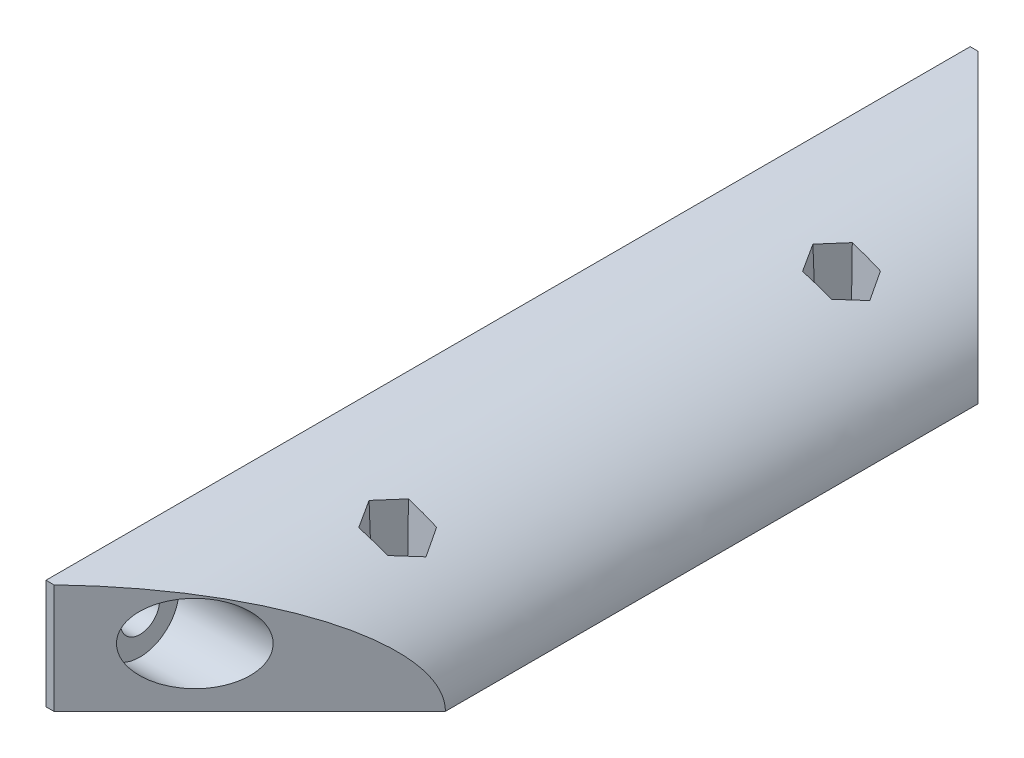
from build123d import *

# Parameters (mm, degrees)
EXTRU_MINCE1_DEPTH      = 118
ESQUISSE2_R             = 2.5
ENL_V_MAT_EXTRU_1_DEPTH = 4
ESQUISSE3_R             = 1.5
ENL_V_MAT_EXTRU_2_DEPTH = 4
CHANFREIN1_SIZE         = 25
BOSS_EXTRU_1_DEPTH      = 118
ESQUISSE5_R             = 2.5
ENL_V_MAT_EXTRU_3_DEPTH = 122.820564897
ESQUISSE6_R             = 1.5
ENL_V_MAT_EXTRU_4_DEPTH = 123.149498698
ENL_V_START             = -3
ESQUISSE8_R             = 5
ENL_V_MAT_EXTRU_5_DEPTH = 119.820564897
ENL_V_MAT_EXTRU_6_DEPTH = 119.9682337
ENL_V_MAT_EXTRU_6_TAPER = -2


with BuildPart() as part:
    # Esquisse1 → Extru.-Mince1 (new body)
    with BuildSketch(Plane.XY):
        Polygon((0, 15.5), (0, 0), (27.5, 0), (27.5, 1.5), (1.5, 1.5), (1.5, 15.5), align=None)
    extrude(amount=EXTRU_MINCE1_DEPTH)

    # Esquisse2 → Enlèv. mat.-Extru.1 (cut)
    with BuildSketch(Plane.ZY):
        with Locations(Location((9, 9, 0), (0, 0, 270))):
            Circle(ESQUISSE2_R)
        with Locations(Location((109, 9, 0), (0, 0, 90))):
            Circle(ESQUISSE2_R)
    extrude(amount=-ENL_V_MAT_EXTRU_1_DEPTH, mode=Mode.SUBTRACT)

    # Esquisse3 → Enlèv. mat.-Extru.2 (cut)
    with BuildSketch(Plane.XZ):
        with Locations(Location((15.771636742, 30.664864187, 0), (0, 0, 270))):
            Circle(ESQUISSE3_R)
        with Locations(Location((15.771636742, 87.335135813, 0), (0, 0, 90))):
            Circle(ESQUISSE3_R)
    extrude(amount=-ENL_V_MAT_EXTRU_2_DEPTH, mode=Mode.SUBTRACT)

    # Chanfrein1
    chanfrein1_edges = [part.edges().sort_by_distance(p)[0] for p in [
        (27.5, 0.75, 0),
        (27.5, 0.75, 118),
    ]]
    chamfer(chanfrein1_edges, length=CHANFREIN1_SIZE)


with BuildPart() as body_2:
    # Esquisse4 → Boss.-Extru.1 (new body)
    with BuildSketch(Plane(origin=(0, 0, 0), x_dir=(-1, 0, 0), z_dir=(0, 0, -1))):
        with BuildLine():
            Line((-27.5, 1.5), (-1.5, 1.5))
            Line((-1.5, 1.5), (-1.5, 15.5))
            add(Edge.make_bspline(
                [(-1.5, 15.5), (-27.5, 15.5), (-27.5, 1.5)],
                knots=[4.71238898, 4.71238898, 4.71238898, 6.283185307, 6.283185307, 6.283185307], degree=2, weights=[1, 0.707106781, 1]))
        make_face()
    extrude(amount=-BOSS_EXTRU_1_DEPTH)

    # Esquisse5 → Enlèv. mat.-Extru.3 (cut, through all)
    with BuildSketch(Plane.ZY.offset(-1.5)):
        with Locations(Location((109, 9, 0), (0, 0, 270))):
            Circle(ESQUISSE5_R)
        with Locations(Location((9, 9, 0), (0, 0, 270))):
            Circle(ESQUISSE5_R)
    extrude(amount=-ENL_V_MAT_EXTRU_3_DEPTH, mode=Mode.SUBTRACT)

    # Esquisse6 → Enlèv. mat.-Extru.4 (cut, through all)
    with BuildSketch(Plane.XZ):
        with Locations(Location((15.771636742, 87.335135813, 0), (0, 0, 270))):
            Circle(ESQUISSE6_R)
        with Locations(Location((15.771636742, 30.664864187, 0), (0, 0, 270))):
            Circle(ESQUISSE6_R)
        Polygon((27.5, 93), (2.5, 118), (27.5, 118), align=None)
        Polygon((2.5, 0), (27.5, 25), (27.5, 0), align=None)
    extrude(amount=-ENL_V_MAT_EXTRU_4_DEPTH, mode=Mode.SUBTRACT)

    # Esquisse8 → Enlèv. mat.-Extru.5 (cut, through all)
    with BuildSketch(Plane.ZY.offset(-1.5).offset(ENL_V_START)):
        with Locations(Location((9, 9, 0), (0, 0, 270))):
            Circle(ESQUISSE8_R)
        with Locations(Location((109, 9, 0), (0, 0, 270))):
            Circle(ESQUISSE8_R)
    extrude(amount=-ENL_V_MAT_EXTRU_5_DEPTH, mode=Mode.SUBTRACT)

    # Esquisse9 → Enlèv. mat.-Extru.6 (cut, through all)
    with BuildSketch(Plane.XZ.offset(-1.5).offset(ENL_V_START)):
        Polygon((19.062533276, 87.335135813), (17.417085009, 90.185135813), (14.126188475, 90.185135813), (12.480740208, 87.335135813), (14.126188475, 84.485135813), (17.417085009, 84.485135813), align=None)
        Polygon((17.417085009, 33.514864187), (14.126188475, 33.514864187), (12.480740208, 30.664864187), (14.126188475, 27.814864187), (17.417085009, 27.814864187), (19.062533276, 30.664864187), align=None)
    extrude(amount=-ENL_V_MAT_EXTRU_6_DEPTH, taper=ENL_V_MAT_EXTRU_6_TAPER, mode=Mode.SUBTRACT)


solid = body_2.part
